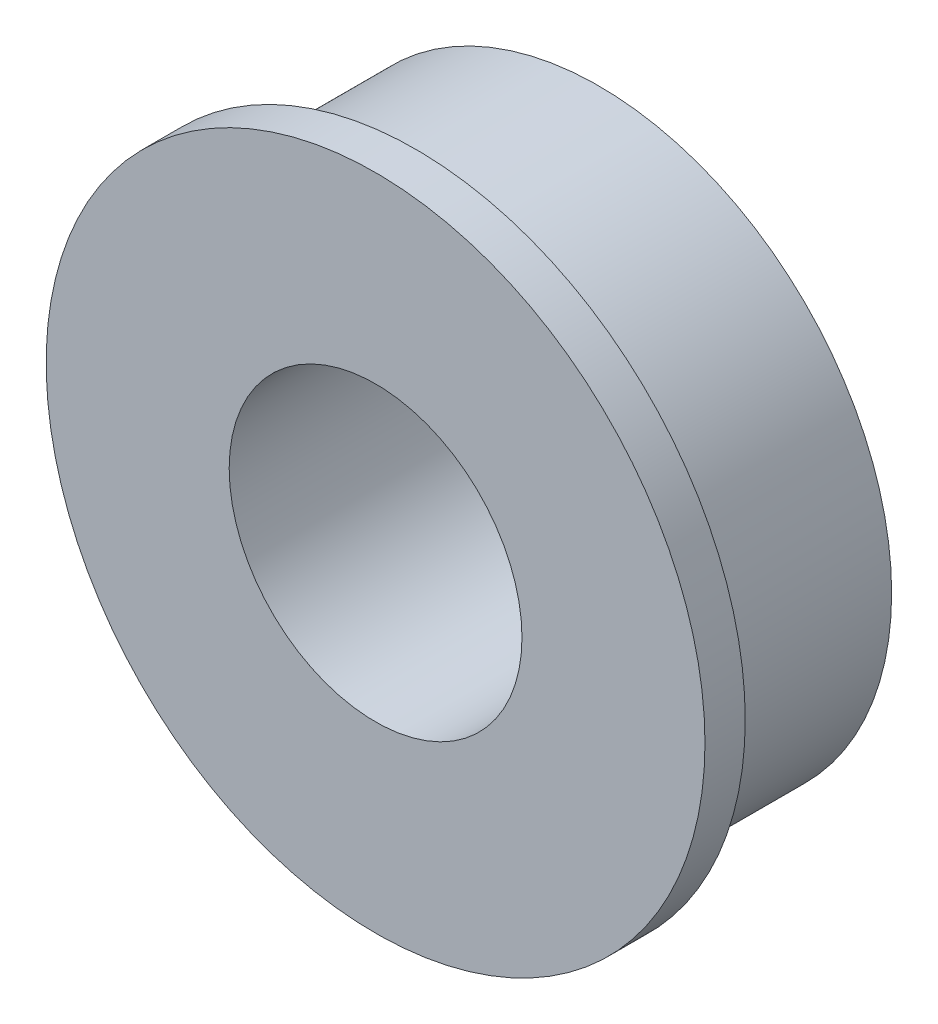
from build123d import *

# Parameters (mm, degrees)
SKETCH_1_R      = 8
SKETCH_1_R_2    = 4
EXTRUDE_1_DEPTH = 5
SKETCH_2_R      = 9
SKETCH_2_R_2    = 4
EXTRUDE_2_DEPTH = 1.1


with BuildPart() as part:
    # 草图1 → 凸台-拉伸1 (new body)
    with BuildSketch(Plane.XY):
        Circle(SKETCH_1_R)
        Circle(SKETCH_1_R_2, mode=Mode.SUBTRACT)
    extrude(amount=EXTRUDE_1_DEPTH)

    # 草图2 → 凸台-拉伸2 (add)
    with BuildSketch(Plane.XY.offset(5)):
        Circle(SKETCH_2_R)
        Circle(SKETCH_2_R_2, mode=Mode.SUBTRACT)
    extrude(amount=EXTRUDE_2_DEPTH)


solid = part.part
